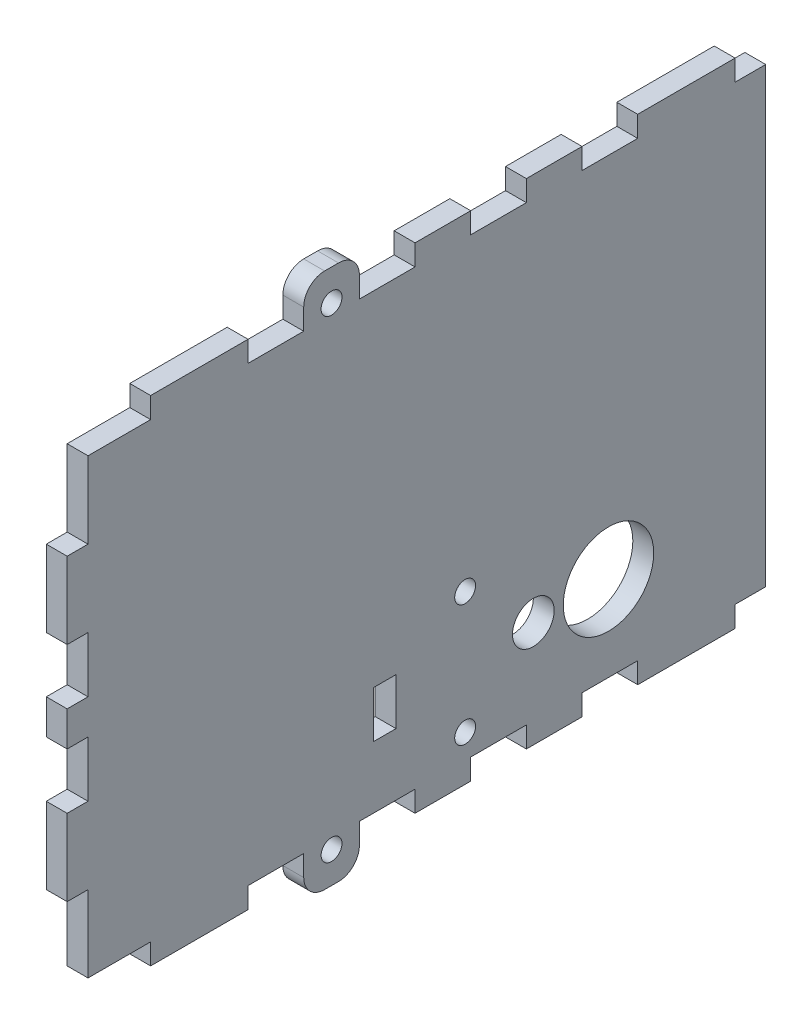
from build123d import *

# Parameters (mm, degrees)
CROQUIS1_W               = 108
CROQUIS1_H               = 71
SALIENTE_EXTRUIR1_DEPTH  = 1.5
CROQUIS2_W               = 12
CROQUIS2_H               = 3
CROQUIS2_W_2             = 8
CORTAR_EXTRUIR1_DEPTH    = 3
CROQUIS4_W               = 8
CROQUIS4_H               = 3
SALIENTE_EXTRUIR2_DEPTH  = 3
REDONDEO1_R              = 3
CROQUIS5_R               = 1.5
CORTAR_EXTRUIR2_DEPTH    = 13
REDONDEO1_OF_SIMETR_A2_R = 3
CROQUIS6_W               = 3
CROQUIS6_H               = 14
CROQUIS6_H_2             = 8
CORTAR_EXTRUIR3_DEPTH    = 3
CROQUIS7_W               = 3.217414859
CROQUIS7_H               = 7.6
CORTAR_EXTRUIR4_DEPTH    = 73
CROQUIS8_R               = 6.5
CROQUIS8_R_2             = 3
CROQUIS8_R_3             = 1.5
CROQUIS8_W               = 3.259373519
CROQUIS8_H               = 6.723882433
CORTAR_EXTRUIR5_DEPTH    = 23


with BuildPart() as part:
    # Croquis1 → Saliente-Extruir1 (new, symmetric)
    with BuildSketch(Plane(origin=(0, 0, 0), x_dir=(0, 0, -1), z_dir=(1, 0, 0))):
        Rectangle(CROQUIS1_W, CROQUIS1_H)
    extrude(amount=SALIENTE_EXTRUIR1_DEPTH, both=True)

    # Croquis2 → Cortar-Extruir1 (cut)
    with BuildSketch(Plane.ZY.offset(1.5)):
        with Locations((-48, -34)):
            Rectangle(CROQUIS2_W, CROQUIS2_H)
        with Locations((-24, -34)):
            Rectangle(CROQUIS2_W_2, CROQUIS2_H)
        with Locations((-8, -34)):
            Rectangle(CROQUIS2_W_2, CROQUIS2_H)
        with Locations((8, -34)):
            Rectangle(CROQUIS2_W_2, CROQUIS2_H)
        with Locations((24, -34)):
            Rectangle(CROQUIS2_W_2, CROQUIS2_H)
        with Locations((48, -34)):
            Rectangle(CROQUIS2_W, CROQUIS2_H)
        with Locations((48, 34)):
            Rectangle(CROQUIS2_W, CROQUIS2_H)
        with Locations((24, 34)):
            Rectangle(CROQUIS2_W_2, CROQUIS2_H)
        with Locations((8, 34)):
            Rectangle(CROQUIS2_W_2, CROQUIS2_H)
        with Locations((-8, 34)):
            Rectangle(CROQUIS2_W_2, CROQUIS2_H)
        with Locations((-24, 34)):
            Rectangle(CROQUIS2_W_2, CROQUIS2_H)
        with Locations((-48, 34)):
            Rectangle(CROQUIS2_W, CROQUIS2_H)
    extrude(amount=-CORTAR_EXTRUIR1_DEPTH, mode=Mode.SUBTRACT)

    # Croquis4 → Saliente-Extruir2 (add)
    with BuildSketch(Plane.ZY.offset(1.5)):
        with Locations((16, 37)):
            Rectangle(CROQUIS4_W, CROQUIS4_H)
    saliente_extruir2 = extrude(amount=-SALIENTE_EXTRUIR2_DEPTH)

    # Redondeo1
    redondeo1_edges = [part.edges().sort_by_distance(p)[0] for p in [
        (0, 38.5, 20),
        (0, 38.5, 12),
    ]]
    fillet(redondeo1_edges, radius=REDONDEO1_R)

    # Croquis5 → Cortar-Extruir2 (cut)
    with BuildSketch(Plane.ZY.offset(1.5)):
        with Locations((16, 34)):
            Circle(CROQUIS5_R)
    cortar_extruir2 = extrude(amount=-CORTAR_EXTRUIR2_DEPTH, mode=Mode.SUBTRACT)

    # Simetría2: Saliente-Extruir2, Cortar-Extruir2 across plane
    add(saliente_extruir2.mirror(Plane.ZX))
    add(cortar_extruir2.mirror(Plane.ZX), mode=Mode.SUBTRACT)

    # Redondeo1 of Simetría2
    redondeo1_of_simetr_a2_edges = [part.edges().sort_by_distance(p)[0] for p in [
        (0, -38.5, 20),
        (0, -38.5, 12),
    ]]
    fillet(redondeo1_of_simetr_a2_edges, radius=REDONDEO1_OF_SIMETR_A2_R)

    # Croquis6 → Cortar-Extruir3 (cut)
    with BuildSketch(Plane.ZY.offset(1.5)):
        with Locations((52.5, -28.5)):
            Rectangle(CROQUIS6_W, CROQUIS6_H)
        with Locations((52.5, -6.5)):
            Rectangle(CROQUIS6_W, CROQUIS6_H_2)
        with Locations((52.5, 6.5)):
            Rectangle(CROQUIS6_W, CROQUIS6_H_2)
        with Locations((52.5, 28.5)):
            Rectangle(CROQUIS6_W, CROQUIS6_H)
    extrude(amount=-CORTAR_EXTRUIR3_DEPTH, mode=Mode.SUBTRACT)

    # Croquis7 → Cortar-Extruir4 (cut)
    with BuildSketch(Plane(origin=(0, 32.5, 0), x_dir=(1, 0, 0), z_dir=(0, 1, 0))):
        with Locations((-0.10870743, 50.2)):
            Rectangle(CROQUIS7_W, CROQUIS7_H)
    extrude(amount=-CORTAR_EXTRUIR4_DEPTH, mode=Mode.SUBTRACT)

    # Croquis8 → Cortar-Extruir5 (cut)
    with BuildSketch(Plane(origin=(1.5, 0, 0), x_dir=(0, 0, -1), z_dir=(1, 0, 0))):
        with Locations((23.8, -20.25)):
            Circle(CROQUIS8_R)
        with Locations((13, -20.25)):
            Circle(CROQUIS8_R_2)
        with Locations((3.2, -11.5)):
            Circle(CROQUIS8_R_3)
        with Locations((3.2, -29)):
            Circle(CROQUIS8_R_3)
        with Locations((-8.36450747, -20.229697644)):
            Rectangle(CROQUIS8_W, CROQUIS8_H)
    extrude(amount=-CORTAR_EXTRUIR5_DEPTH, mode=Mode.SUBTRACT)


solid = part.part
